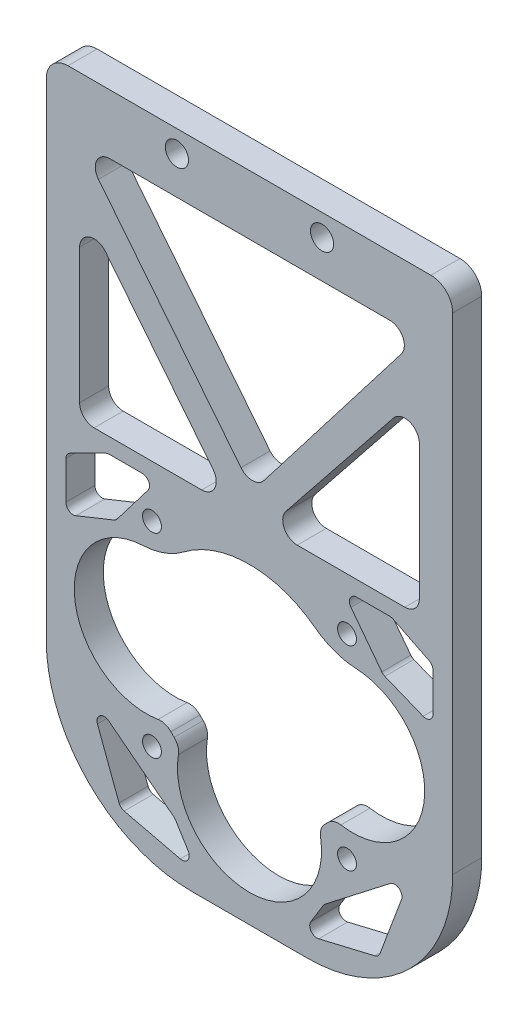
from build123d import *

# Parameters (mm, degrees)
SKETCH_1_W          = 56
SKETCH_1_H          = 90
SKETCH_1_R          = 1.6
SKETCH_1_R_2        = 1.3
SKETCH_1_R_3        = 15
EXTRUDE_1_DEPTH     = 4
FILLET_1_R          = 20
CUT_EXTRUDE_1_DEPTH = 54.150729064
FILLET_2_R          = 2
FILLET_3_R          = 3
CUT_EXTRUDE_2_DEPTH = 54.150729064
FILLET_4_R          = 10
FILLET_5_R          = 2
CUT_EXTRUDE_3_DEPTH = 54.150729209
FILLET_6_R          = 1
CUT_EXTRUDE_4_DEPTH = 54.150729209
FILLET_7_R          = 1


with BuildPart() as part:
    # 草图1 → 凸台-拉伸1 (new body)
    with BuildSketch(Plane.XY):
        Rectangle(SKETCH_1_W, SKETCH_1_H)
        with Locations((10, 42)):
            Circle(SKETCH_1_R, mode=Mode.SUBTRACT)
        with Locations(Location((-10, 42, 0), (0, 0, 180))):
            Circle(SKETCH_1_R, mode=Mode.SUBTRACT)
        with Locations((13.435028843, -3.564971157)):
            Circle(SKETCH_1_R_2, mode=Mode.SUBTRACT)
        with Locations((13.435028843, -30.435028843)):
            Circle(SKETCH_1_R_2, mode=Mode.SUBTRACT)
        with Locations((-13.435028843, -30.435028843)):
            Circle(SKETCH_1_R_2, mode=Mode.SUBTRACT)
        with Locations((-13.435028843, -3.564971157)):
            Circle(SKETCH_1_R_2, mode=Mode.SUBTRACT)
        with Locations((0, -17)):
            Circle(SKETCH_1_R_3, mode=Mode.SUBTRACT)
    extrude(amount=EXTRUDE_1_DEPTH)

    # 圆角1
    fillet_1_edges = [part.edges().sort_by_distance(p)[0] for p in [
        (28, -45, 2),
        (-28, -45, 2),
    ]]
    fillet(fillet_1_edges, radius=FILLET_1_R)

    # 草图2 → 切除-拉伸1 (cut, through all)
    with BuildSketch(Plane.XY.offset(4)):
        Polygon((-23.403006558, 36.792468572), (23.403006558, 36.792468572), (0.426117862, 6.963948605), align=None)
        Polygon((-23.403006558, 29.851631864), (-23.403006558, 3.588347177), (-2.422043399, 3.588347177), align=None)
        Polygon((23.403006558, 3.588347177), (2.422043399, 3.588347177), (23.403006558, 29.851631864), align=None)
    extrude(amount=-CUT_EXTRUDE_1_DEPTH, mode=Mode.SUBTRACT)

    # 圆角2
    fillet_2_edges = [part.edges().sort_by_distance(p)[0] for p in [
        (23.403006558, 29.851631864, 2),
        (23.403006558, 3.588347177, 2),
        (2.422043399, 3.588347177, 2),
        (-23.403006558, 29.851631864, 2),
        (-2.422043399, 3.588347177, 2),
        (-23.403006558, 3.588347177, 2),
        (0.426117862, 6.963948605, 2),
        (-23.403006558, 36.792468572, 2),
        (23.403006558, 36.792468572, 2),
    ]]
    fillet(fillet_2_edges, radius=FILLET_2_R)

    # 圆角3
    fillet_3_edges = [part.edges().sort_by_distance(p)[0] for p in [
        (-28, 45, 2),
        (28, 45, 2),
    ]]
    fillet(fillet_3_edges, radius=FILLET_3_R)

    # 草图3 → 切除-拉伸2 (cut, through all)
    with BuildSketch(Plane.XY.offset(4)):
        with BuildLine():
            ThreePointArc((-9.563715622, -28.55574937), (0, -41.141196435), (9.563715622, -28.55574937))
            ThreePointArc((9.563715622, -28.55574937), (0, -32), (-9.563715622, -28.55574937))
        make_face()
        with BuildLine():
            ThreePointArc((-11.55574937, -7.436284378), (-24.141196435, -17), (-11.55574937, -26.563715622))
            ThreePointArc((-11.55574937, -26.563715622), (-15, -17), (-11.55574937, -7.436284378))
        make_face()
        with BuildLine():
            ThreePointArc((11.55574937, -26.563715622), (24.141196435, -17), (11.55574937, -7.436284378))
            ThreePointArc((11.55574937, -7.436284378), (15, -17), (11.55574937, -26.563715622))
        make_face()
    extrude(amount=-CUT_EXTRUDE_2_DEPTH, mode=Mode.SUBTRACT)

    # 圆角4
    fillet_4_edges = [part.edges().sort_by_distance(p)[0] for p in [
        (-11.55574937, -7.436284378, 2),
        (11.55574937, -7.436284378, 2),
    ]]
    fillet(fillet_4_edges, radius=FILLET_4_R)

    # 圆角5
    fillet_5_edges = [part.edges().sort_by_distance(p)[0] for p in [
        (-9.563715622, -28.55574937, 2),
        (9.563715622, -28.55574937, 2),
        (-11.55574937, -26.563715622, 2),
        (11.55574937, -26.563715622, 2),
    ]]
    fillet(fillet_5_edges, radius=FILLET_5_R)

    # 草图4 → 切除-拉伸3 (cut, through all)
    with BuildSketch(Plane.XY.offset(4)):
        Polygon((-22.184991746, -28.213177479), (-10.282808815, -37.433178341), (-7.181535798, -42.46226972), (-17.786358924, -39.94772403), align=None)
        Polygon((7.181535798, -42.46226972), (17.786358924, -39.94772403), (22.184991746, -28.213177479), (10.282808815, -37.433178341), align=None)
    extrude(amount=-CUT_EXTRUDE_3_DEPTH, mode=Mode.SUBTRACT)

    # 圆角6
    fillet_6_edges = [part.edges().sort_by_distance(p)[0] for p in [
        (-17.786358924, -39.94772403, 2),
        (-22.184991746, -28.213177479, 2),
        (-10.282808815, -37.433178341, 2),
        (-7.181535798, -42.46226972, 2),
        (7.181535798, -42.46226972, 2),
        (10.282808815, -37.433178341, 2),
        (22.184991746, -28.213177479, 2),
        (17.786358924, -39.94772403, 2),
    ]]
    fillet(fillet_6_edges, radius=FILLET_6_R)

    # 草图5 → 切除-拉伸4 (cut, through all)
    with BuildSketch(Plane.XY.offset(4)):
        Polygon((-19.572914927, 1.476160836), (-25.295441932, -1.385102666), (-25.295441932, -8.70657104), (-18.394747603, -5.929462346), (-12.756375408, 1.476160836), align=None)
        Polygon((18.394747603, -5.929462346), (12.756375408, 1.476160836), (19.572914927, 1.476160836), (25.295441932, -1.385102666), (25.295441932, -8.70657104), align=None)
    extrude(amount=-CUT_EXTRUDE_4_DEPTH, mode=Mode.SUBTRACT)

    # 圆角7
    fillet_7_edges = [part.edges().sort_by_distance(p)[0] for p in [
        (-19.572914927, 1.476160836, 2),
        (-12.756375408, 1.476160836, 2),
        (-18.394747603, -5.929462346, 2),
        (-25.295441932, -8.70657104, 2),
        (-25.295441932, -1.385102666, 2),
        (25.295441932, -8.70657104, 2),
        (18.394747603, -5.929462346, 2),
        (12.756375408, 1.476160836, 2),
        (19.572914927, 1.476160836, 2),
        (25.295441932, -1.385102666, 2),
    ]]
    fillet(fillet_7_edges, radius=FILLET_7_R)


solid = part.part
